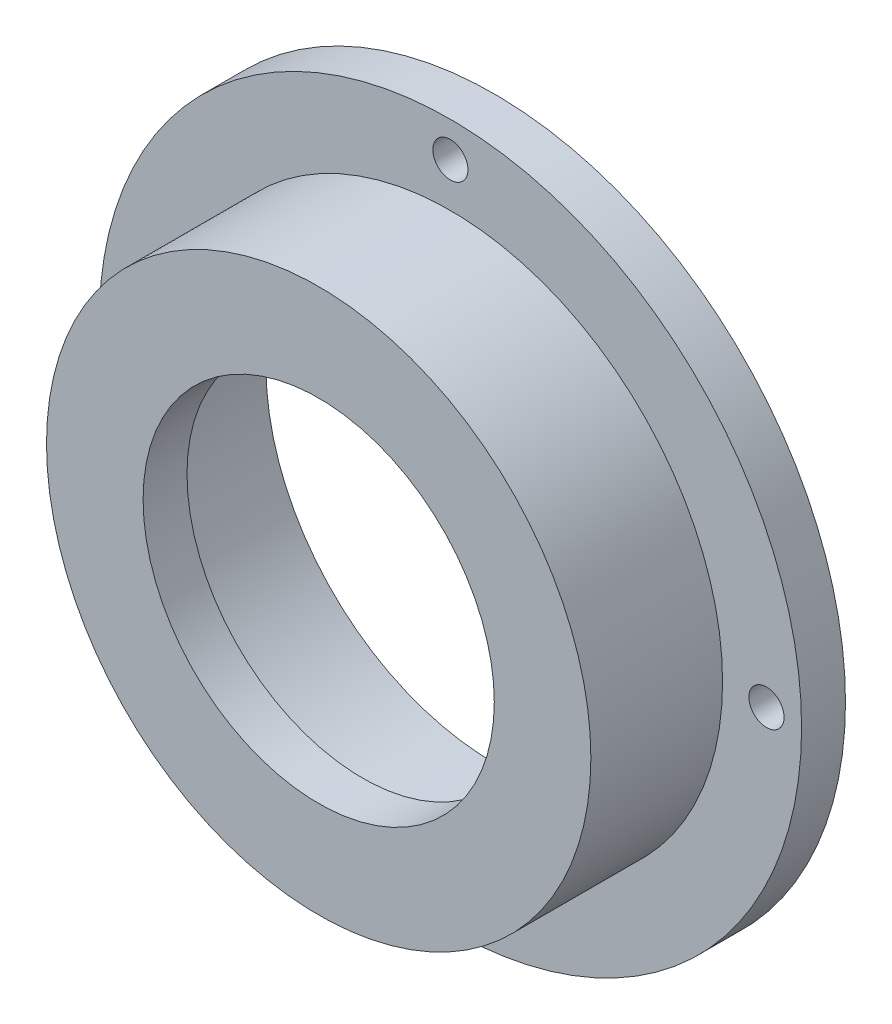
from build123d import *

# Parameters (mm, degrees)
SKETCH_1_R               = 40
EXTRUDE_1_DEPTH          = 5
SKETCH_2_R               = 31
EXTRUDE_2_DEPTH          = 12
SKETCH_3_R               = 26
CUT_EXTRUDE_1_DEPTH      = 15
SKETCH_4_R               = 31
EXTRUDE_3_DEPTH          = 3
SKETCH_6_R               = 2
CUT_EXTRUDE_3_DEPTH      = 5
PATTERN_CIRCULAR_1_COUNT = 4
SKETCH_7_R               = 20
CUT_EXTRUDE_4_DEPTH      = 10


with BuildPart() as part:
    # 草图1 → 凸台-拉伸1 (new body)
    with BuildSketch(Plane.XY):
        Circle(SKETCH_1_R)
    extrude(amount=EXTRUDE_1_DEPTH)

    # 草图2 → 凸台-拉伸2 (add)
    with BuildSketch(Plane.XY.offset(5)):
        Circle(SKETCH_2_R)
    extrude(amount=EXTRUDE_2_DEPTH)

    # 草图3 → 切除-拉伸1 (cut)
    with BuildSketch(Plane(origin=(0, 0, 0), x_dir=(-1, 0, 0), z_dir=(0, 0, -1))):
        Circle(SKETCH_3_R)
    extrude(amount=-CUT_EXTRUDE_1_DEPTH, mode=Mode.SUBTRACT)

    # 草图4 → 凸台-拉伸3 (add)
    with BuildSketch(Plane.XY.offset(17)):
        Circle(SKETCH_4_R)
    extrude(amount=EXTRUDE_3_DEPTH)

    # 草图6 → 切除-拉伸3 (cut)
    with BuildSketch(Plane(origin=(0, 0, 0), x_dir=(-1, 0, 0), z_dir=(0, 0, -1))):
        with Locations((0, 36)):
            Circle(SKETCH_6_R)
    cut_extrude_3 = extrude(amount=-CUT_EXTRUDE_3_DEPTH, mode=Mode.SUBTRACT)

    # 阵列(圆周)1: 切除-拉伸3 ×4 about axis
    pattern_circular_1_axis = Axis((0, 0, 0), (0, 0, 1))
    for i in range(1, PATTERN_CIRCULAR_1_COUNT):
        add(cut_extrude_3.rotate(pattern_circular_1_axis, i * 360 / PATTERN_CIRCULAR_1_COUNT), mode=Mode.SUBTRACT)

    # 草图7 → 切除-拉伸4 (cut)
    with BuildSketch(Plane.XY.offset(20)):
        Circle(SKETCH_7_R)
    extrude(amount=-CUT_EXTRUDE_4_DEPTH, mode=Mode.SUBTRACT)


solid = part.part
